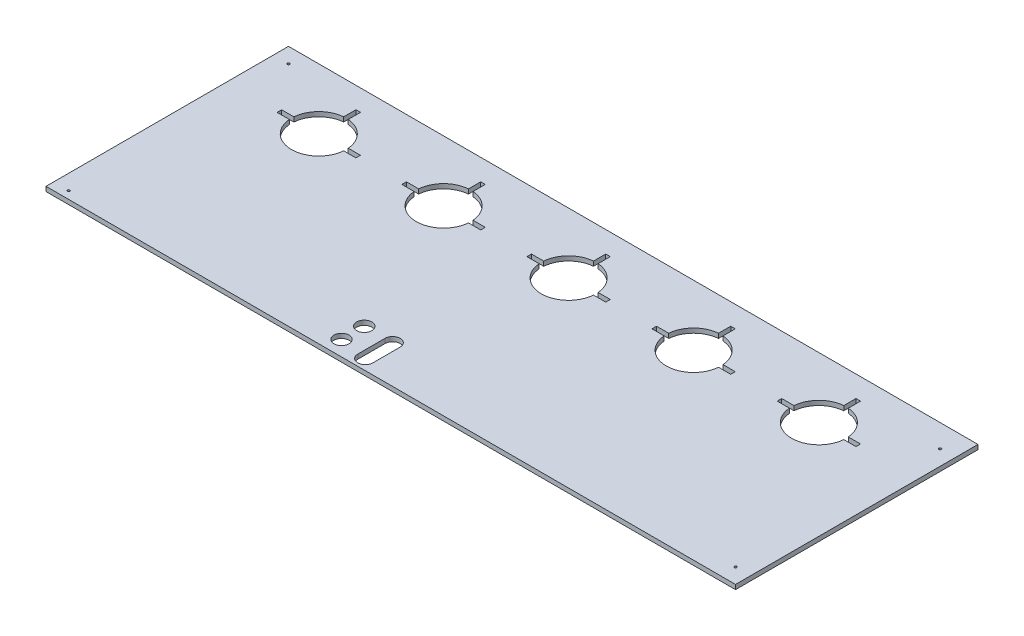
from build123d import *

# Parameters (mm, degrees)
SKETCH1_W                      = 455
SKETCH1_H                      = 160
BOSS_EXTRUDE1_DEPTH            = 3
SKETCH2_R                      = 18
SKETCH2_R_2                    = 5
CUT_EXTRUDE1_DEPTH             = 3
F_1_16_0_0625_DIAMETER_HOLE2_D = 1.5875
CUT_EXTRUDE2_DEPTH             = 10
SKETCH7_4_W                    = 3
SKETCH7_4_H                    = 26
CUT_EXTRUDE3_DEPTH             = 10


with BuildPart() as part:
    # Sketch1 → Boss-Extrude1 (new body)
    with BuildSketch(Plane(origin=(0, 0, 0), x_dir=(1, 0, 0), z_dir=(0, 1, 0))):
        Rectangle(SKETCH1_W, SKETCH1_H)
    extrude(amount=BOSS_EXTRUDE1_DEPTH)

    # Sketch2 → Cut-Extrude1 (cut)
    with BuildSketch(Plane(origin=(0, 3, 0), x_dir=(1, 0, 0), z_dir=(0, 1, 0))):
        with Locations((-167.5, 40)):
            Circle(SKETCH2_R)
        with Locations((-85.151099534, 40)):
            Circle(SKETCH2_R)
        with Locations((-2.651099534, 40)):
            Circle(SKETCH2_R)
        with Locations((79.848900466, 39.999983289)):
            Circle(SKETCH2_R)
        with Locations((162.5, 40)):
            Circle(SKETCH2_R)
        with Locations((-42.5, -55)):
            Circle(SKETCH2_R_2)
        with Locations((-42.5, -70)):
            Circle(SKETCH2_R_2)
        with BuildLine():
            Line((-28.777964672, -55), (-28.777964672, -73))
            ThreePointArc((-28.777964672, -73), (-23.777964672, -78), (-18.777964672, -73))
            Line((-18.777964672, -73), (-18.777964672, -55))
            ThreePointArc((-18.777964672, -55), (-23.777964672, -50), (-28.777964672, -55))
        make_face()
    extrude(amount=-CUT_EXTRUDE1_DEPTH, mode=Mode.SUBTRACT)

    # 1/16 (0.0625) Diameter Hole2 (through all)
    with Locations(Plane(origin=(0, 3, 0), x_dir=(1, 0, 0), z_dir=(0, 1, 0))):
        with Locations((-217.5, -75), (-217.5, 70), (217.5, -70), (217.5, 65)):
            Hole(F_1_16_0_0625_DIAMETER_HOLE2_D / 2)

    # Sketch7 → Cut-Extrude2 (cut)
    with BuildSketch(Plane(origin=(0, 3, 0), x_dir=(1, 0, 0), z_dir=(0, 1, 0))):
        with BuildLine():
            Line((-149.562608885, 38.5), (-141.5, 38.5))
            Line((-141.5, 38.5), (-141.5, 41.5))
            Line((-141.5, 41.5), (-149.562608885, 41.5))
            ThreePointArc((-149.562608885, 41.5), (-149.5, 40), (-149.562608885, 38.5))
        make_face()
        with BuildLine():
            Line((-193.5, 38.5), (-185.437391115, 38.5))
            ThreePointArc((-185.437391115, 38.5), (-185.5, 40), (-185.437391115, 41.5))
            Line((-185.437391115, 41.5), (-193.5, 41.5))
            Line((-193.5, 41.5), (-193.5, 38.5))
        make_face()
        with BuildLine():
            ThreePointArc((-169.022220782, 57.935519058), (-167.522298342, 57.999986188), (-166.022220782, 57.939235451))
            Line((-166.022220782, 57.939235451), (-166.022220782, 66.086538462))
            Line((-166.022220782, 66.086538462), (-169.022220782, 66.086538462))
            Line((-169.022220782, 66.086538462), (-169.022220782, 57.935519058))
        make_face()
    extrude(amount=-CUT_EXTRUDE2_DEPTH, mode=Mode.SUBTRACT)

    # Sketch7<4> → Cut-Extrude3 (cut)
    with BuildSketch(Plane(origin=(0, 3, 0), x_dir=(1, 0, 0), z_dir=(0, 1, 0))):
        with BuildLine():
            Line((-111.151099534, 38.5), (-103.088490649, 38.5))
            ThreePointArc((-103.088490649, 38.5), (-103.151099534, 40), (-103.088490649, 41.5))
            Line((-103.088490649, 41.5), (-111.151099534, 41.5))
            Line((-111.151099534, 41.5), (-111.151099534, 38.5))
        make_face()
        with BuildLine():
            ThreePointArc((-67.21370842, 41.5), (-67.151099534, 40), (-67.21370842, 38.5))
            Line((-67.21370842, 38.5), (-59.151099534, 38.5))
            Line((-59.151099534, 38.5), (-59.151099534, 41.5))
            Line((-59.151099534, 41.5), (-67.21370842, 41.5))
        make_face()
        with Locations((-85.151099534, 53)):
            Rectangle(SKETCH7_4_W, SKETCH7_4_H)
        with BuildLine():
            Line((97.78629158, 38.499983289), (105.848900466, 38.499983289))
            Line((105.848900466, 38.499983289), (105.848900466, 41.499983289))
            Line((105.848900466, 41.499983289), (97.78629158, 41.499983289))
            ThreePointArc((97.78629158, 41.499983289), (97.848900466, 39.999983289), (97.78629158, 38.499983289))
        make_face()
        with BuildLine():
            Line((53.848900466, 38.499983289), (61.911509351, 38.499983289))
            ThreePointArc((61.911509351, 38.499983289), (61.848900466, 39.999983289), (61.911509351, 41.499983289))
            Line((61.911509351, 41.499983289), (53.848900466, 41.499983289))
            Line((53.848900466, 41.499983289), (53.848900466, 38.499983289))
        make_face()
        with BuildLine():
            ThreePointArc((78.348900466, 57.937374404), (79.848900466, 57.999983289), (81.348900466, 57.937374404))
            Line((81.348900466, 57.937374404), (81.348900466, 65.999983289))
            Line((81.348900466, 65.999983289), (78.348900466, 65.999983289))
            Line((78.348900466, 65.999983289), (78.348900466, 57.937374404))
        make_face()
        with BuildLine():
            Line((180.437391115, 38.5), (188.5, 38.5))
            Line((188.5, 38.5), (188.5, 41.5))
            Line((188.5, 41.5), (180.437391115, 41.5))
            ThreePointArc((180.437391115, 41.5), (180.5, 40), (180.437391115, 38.5))
        make_face()
        with BuildLine():
            Line((136.5, 38.5), (144.562608885, 38.5))
            ThreePointArc((144.562608885, 38.5), (144.5, 40), (144.562608885, 41.5))
            Line((144.562608885, 41.5), (136.5, 41.5))
            Line((136.5, 41.5), (136.5, 38.5))
        make_face()
        with BuildLine():
            ThreePointArc((161, 57.937391115), (162.5, 58), (164, 57.937391115))
            Line((164, 57.937391115), (164, 66))
            Line((164, 66), (161, 66))
            Line((161, 66), (161, 57.937391115))
        make_face()
        with BuildLine():
            Line((15.28629158, 38.5), (23.348900466, 38.5))
            Line((23.348900466, 38.5), (23.348900466, 41.5))
            Line((23.348900466, 41.5), (15.28629158, 41.5))
            ThreePointArc((15.28629158, 41.5), (15.348900466, 40), (15.28629158, 38.5))
        make_face()
        with BuildLine():
            Line((-28.651099534, 38.5), (-20.588490649, 38.5))
            ThreePointArc((-20.588490649, 38.5), (-20.651099534, 40), (-20.588490649, 41.5))
            Line((-20.588490649, 41.5), (-28.651099534, 41.5))
            Line((-28.651099534, 41.5), (-28.651099534, 38.5))
        make_face()
        with BuildLine():
            ThreePointArc((-4.151099534, 57.937391115), (-2.651099534, 58), (-1.151099534, 57.937391115))
            Line((-1.151099534, 57.937391115), (-1.151099534, 66))
            Line((-1.151099534, 66), (-4.151099534, 66))
            Line((-4.151099534, 66), (-4.151099534, 57.937391115))
        make_face()
    extrude(amount=-CUT_EXTRUDE3_DEPTH, mode=Mode.SUBTRACT)


solid = part.part
